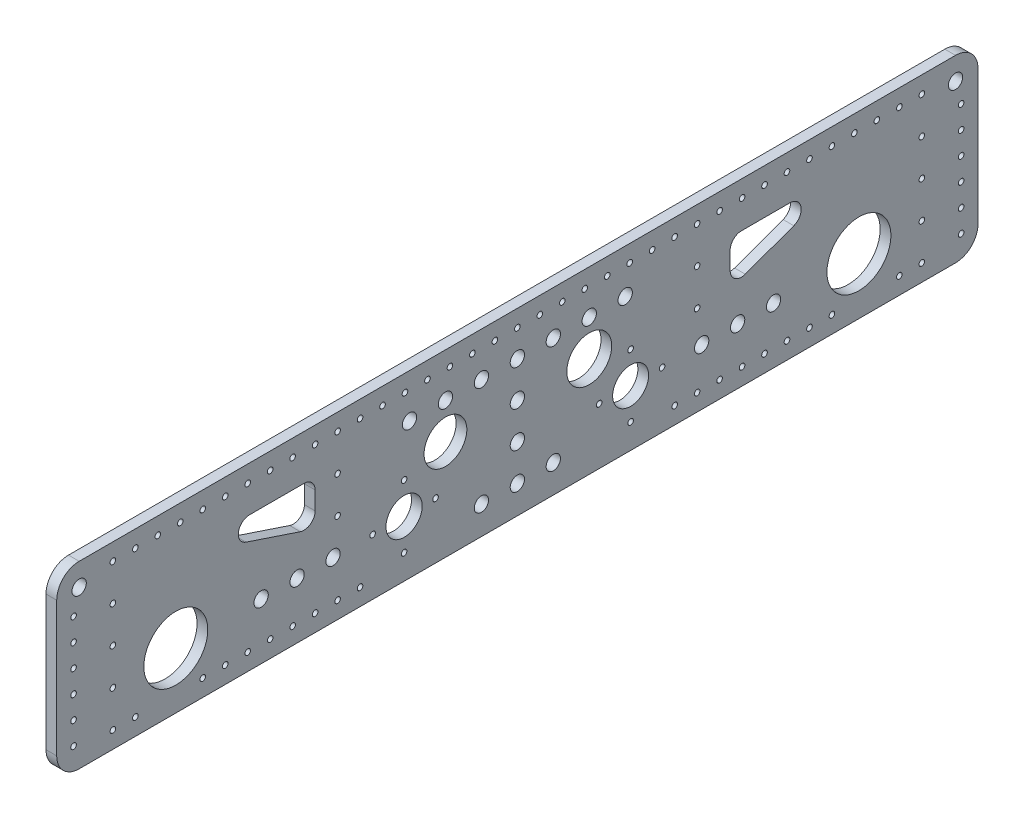
from build123d import *

# Parameters (mm, degrees)
SKETCH2_R           = 14.225
SKETCH2_R_2         = 3.18
SKETCH2_R_3         = 1.25
SKETCH2_R_4         = 8
SKETCH2_R_5         = 8.068284678
SKETCH2_R_6         = 9.513895284
SKETCH2_R_7         = 10
BOSS_EXTRUDE1_DEPTH = 4.7625


with BuildPart() as part:
    # Sketch2 → Boss-Extrude1 (new body)
    with BuildSketch(Plane(origin=(0, 0, 0), x_dir=(0, 0, -1), z_dir=(1, 0, 0))):
        with BuildLine():
            Line((-23.472321429, 28.668303571), (-23.472321429, -31.331696429))
            ThreePointArc((-23.472321429, -31.331696429), (-20.54338924, -38.40276424), (-13.472321429, -41.331696429))
            Line((-13.472321429, -41.331696429), (376.527678571, -41.331696429))
            ThreePointArc((376.527678571, -41.331696429), (383.598746383, -38.40276424), (386.527678571, -31.331696429))
            Line((386.527678571, -31.331696429), (386.527678571, 28.668303571))
            ThreePointArc((386.527678571, 28.668303571), (383.598746383, 35.739371383), (376.527678571, 38.668303571))
            Line((376.527678571, 38.668303571), (-13.472321429, 38.668303571))
            ThreePointArc((-13.472321429, 38.668303571), (-20.54338924, 35.739371383), (-23.472321429, 28.668303571))
        make_face()
        with Locations(Location((29.527678571, -16.331696429, 0), (0, 0, 180))):
            Circle(SKETCH2_R, mode=Mode.SUBTRACT)
        with Locations(Location((333.527678571, -16.331696429, 0), (0, 0, 180))):
            Circle(SKETCH2_R, mode=Mode.SUBTRACT)
        with Locations(Location((181.527678571, -28.771696429, 0), (0, 0, 180))):
            Circle(SKETCH2_R_2, mode=Mode.SUBTRACT)
        with Locations(Location((197.527678571, -28.771696429, 0), (0, 0, 180))):
            Circle(SKETCH2_R_2, mode=Mode.SUBTRACT)
        with Locations(Location((197.527678571, 19.228303571, 0), (0, 0, 180))):
            Circle(SKETCH2_R_2, mode=Mode.SUBTRACT)
        with Locations(Location((181.527678571, -12.771696429, 0), (0, 0, 180))):
            Circle(SKETCH2_R_2, mode=Mode.SUBTRACT)
        with Locations(Location((181.527678571, 3.228303571, 0), (0, 0, 180))):
            Circle(SKETCH2_R_2, mode=Mode.SUBTRACT)
        with Locations(Location((181.527678571, 19.228303571, 0), (0, 0, 180))):
            Circle(SKETCH2_R_2, mode=Mode.SUBTRACT)
        with Locations(Location((165.527678571, -28.771696429, 0), (0, 0, 180))):
            Circle(SKETCH2_R_2, mode=Mode.SUBTRACT)
        with Locations(Location((165.527678571, 19.228303571, 0), (0, 0, 180))):
            Circle(SKETCH2_R_2, mode=Mode.SUBTRACT)
        with Locations(Location((83.502678571, -16.331696429, 0), (0, 0, 180))):
            Circle(SKETCH2_R_2, mode=Mode.SUBTRACT)
        with Locations(Location((279.552678571, -16.331696429, 0), (0, 0, 180))):
            Circle(SKETCH2_R_2, mode=Mode.SUBTRACT)
        with Locations(Location((1.527678571, 31.168303571, 0), (0, 0, 180))):
            Circle(SKETCH2_R_3, mode=Mode.SUBTRACT)
        with Locations(Location((11.527678571, 31.168303571, 0), (0, 0, 180))):
            Circle(SKETCH2_R_3, mode=Mode.SUBTRACT)
        with Locations(Location((21.527678571, 31.168303571, 0), (0, 0, 180))):
            Circle(SKETCH2_R_3, mode=Mode.SUBTRACT)
        with Locations(Location((31.527678571, 31.168303571, 0), (0, 0, 180))):
            Circle(SKETCH2_R_3, mode=Mode.SUBTRACT)
        with Locations(Location((41.527678571, 31.168303571, 0), (0, 0, 180))):
            Circle(SKETCH2_R_3, mode=Mode.SUBTRACT)
        with Locations(Location((51.527678571, 31.168303571, 0), (0, 0, 180))):
            Circle(SKETCH2_R_3, mode=Mode.SUBTRACT)
        with Locations(Location((61.527678571, 31.168303571, 0), (0, 0, 180))):
            Circle(SKETCH2_R_3, mode=Mode.SUBTRACT)
        with Locations(Location((71.527678571, 31.168303571, 0), (0, 0, 180))):
            Circle(SKETCH2_R_3, mode=Mode.SUBTRACT)
        with Locations(Location((81.527678571, 31.168303571, 0), (0, 0, 180))):
            Circle(SKETCH2_R_3, mode=Mode.SUBTRACT)
        with Locations(Location((91.527678571, 31.168303571, 0), (0, 0, 180))):
            Circle(SKETCH2_R_3, mode=Mode.SUBTRACT)
        with Locations(Location((101.527678571, 31.168303571, 0), (0, 0, 180))):
            Circle(SKETCH2_R_3, mode=Mode.SUBTRACT)
        with Locations(Location((111.527678571, 31.168303571, 0), (0, 0, 180))):
            Circle(SKETCH2_R_3, mode=Mode.SUBTRACT)
        with Locations(Location((121.527678571, 31.168303571, 0), (0, 0, 180))):
            Circle(SKETCH2_R_3, mode=Mode.SUBTRACT)
        with Locations(Location((131.527678571, 31.168303571, 0), (0, 0, 180))):
            Circle(SKETCH2_R_3, mode=Mode.SUBTRACT)
        with Locations(Location((141.527678571, 31.168303571, 0), (0, 0, 180))):
            Circle(SKETCH2_R_3, mode=Mode.SUBTRACT)
        with Locations(Location((151.527678571, 31.168303571, 0), (0, 0, 180))):
            Circle(SKETCH2_R_3, mode=Mode.SUBTRACT)
        with Locations(Location((161.527678571, 31.168303571, 0), (0, 0, 180))):
            Circle(SKETCH2_R_3, mode=Mode.SUBTRACT)
        with Locations(Location((171.527678571, 31.168303571, 0), (0, 0, 180))):
            Circle(SKETCH2_R_3, mode=Mode.SUBTRACT)
        with Locations(Location((181.527678571, 31.168303571, 0), (0, 0, 180))):
            Circle(SKETCH2_R_3, mode=Mode.SUBTRACT)
        with Locations(Location((191.527678571, 31.168303571, 0), (0, 0, 180))):
            Circle(SKETCH2_R_3, mode=Mode.SUBTRACT)
        with Locations(Location((201.527678571, 31.168303571, 0), (0, 0, 180))):
            Circle(SKETCH2_R_3, mode=Mode.SUBTRACT)
        with Locations(Location((211.527678571, 31.168303571, 0), (0, 0, 180))):
            Circle(SKETCH2_R_3, mode=Mode.SUBTRACT)
        with Locations(Location((221.527678571, 31.168303571, 0), (0, 0, 180))):
            Circle(SKETCH2_R_3, mode=Mode.SUBTRACT)
        with Locations(Location((231.527678571, 31.168303571, 0), (0, 0, 180))):
            Circle(SKETCH2_R_3, mode=Mode.SUBTRACT)
        with Locations(Location((241.527678571, 31.168303571, 0), (0, 0, 180))):
            Circle(SKETCH2_R_3, mode=Mode.SUBTRACT)
        with Locations(Location((251.527678571, 31.168303571, 0), (0, 0, 180))):
            Circle(SKETCH2_R_3, mode=Mode.SUBTRACT)
        with Locations(Location((261.527678571, 31.168303571, 0), (0, 0, 180))):
            Circle(SKETCH2_R_3, mode=Mode.SUBTRACT)
        with Locations(Location((271.527678571, 31.168303571, 0), (0, 0, 180))):
            Circle(SKETCH2_R_3, mode=Mode.SUBTRACT)
        with Locations(Location((281.527678571, 31.168303571, 0), (0, 0, 180))):
            Circle(SKETCH2_R_3, mode=Mode.SUBTRACT)
        with Locations(Location((291.527678571, 31.168303571, 0), (0, 0, 180))):
            Circle(SKETCH2_R_3, mode=Mode.SUBTRACT)
        with Locations(Location((301.527678571, 31.168303571, 0), (0, 0, 180))):
            Circle(SKETCH2_R_3, mode=Mode.SUBTRACT)
        with Locations(Location((311.527678571, 31.168303571, 0), (0, 0, 180))):
            Circle(SKETCH2_R_3, mode=Mode.SUBTRACT)
        with Locations(Location((321.527678571, 31.168303571, 0), (0, 0, 180))):
            Circle(SKETCH2_R_3, mode=Mode.SUBTRACT)
        with Locations(Location((331.527678571, 31.168303571, 0), (0, 0, 180))):
            Circle(SKETCH2_R_3, mode=Mode.SUBTRACT)
        with Locations(Location((341.527678571, 31.168303571, 0), (0, 0, 180))):
            Circle(SKETCH2_R_3, mode=Mode.SUBTRACT)
        with Locations(Location((351.527678571, 31.168303571, 0), (0, 0, 180))):
            Circle(SKETCH2_R_3, mode=Mode.SUBTRACT)
        with Locations(Location((361.527678571, 31.168303571, 0), (0, 0, 180))):
            Circle(SKETCH2_R_3, mode=Mode.SUBTRACT)
        with Locations(Location((1.527678571, -33.831696429, 0), (0, 0, 180))):
            Circle(SKETCH2_R_3, mode=Mode.SUBTRACT)
        with Locations(Location((11.527678571, -33.831696429, 0), (0, 0, 180))):
            Circle(SKETCH2_R_3, mode=Mode.SUBTRACT)
        with Locations(Location((41.527678571, -33.831696429, 0), (0, 0, 180))):
            Circle(SKETCH2_R_3, mode=Mode.SUBTRACT)
        with Locations(Location((51.527678571, -33.831696429, 0), (0, 0, 180))):
            Circle(SKETCH2_R_3, mode=Mode.SUBTRACT)
        with Locations(Location((61.527678571, -33.831696429, 0), (0, 0, 180))):
            Circle(SKETCH2_R_3, mode=Mode.SUBTRACT)
        with Locations(Location((71.527678571, -33.831696429, 0), (0, 0, 180))):
            Circle(SKETCH2_R_3, mode=Mode.SUBTRACT)
        with Locations(Location((81.527678571, -33.831696429, 0), (0, 0, 180))):
            Circle(SKETCH2_R_3, mode=Mode.SUBTRACT)
        with Locations(Location((91.527678571, -33.831696429, 0), (0, 0, 180))):
            Circle(SKETCH2_R_3, mode=Mode.SUBTRACT)
        with Locations(Location((101.527678571, -33.831696429, 0), (0, 0, 180))):
            Circle(SKETCH2_R_3, mode=Mode.SUBTRACT)
        with Locations(Location((111.527678571, -33.831696429, 0), (0, 0, 180))):
            Circle(SKETCH2_R_3, mode=Mode.SUBTRACT)
        with Locations(Location((251.527678571, -33.831696429, 0), (0, 0, 180))):
            Circle(SKETCH2_R_3, mode=Mode.SUBTRACT)
        with Locations(Location((261.527678571, -33.831696429, 0), (0, 0, 180))):
            Circle(SKETCH2_R_3, mode=Mode.SUBTRACT)
        with Locations(Location((271.527678571, -33.831696429, 0), (0, 0, 180))):
            Circle(SKETCH2_R_3, mode=Mode.SUBTRACT)
        with Locations(Location((281.527678571, -33.831696429, 0), (0, 0, 180))):
            Circle(SKETCH2_R_3, mode=Mode.SUBTRACT)
        with Locations(Location((291.527678571, -33.831696429, 0), (0, 0, 180))):
            Circle(SKETCH2_R_3, mode=Mode.SUBTRACT)
        with Locations(Location((301.527678571, -33.831696429, 0), (0, 0, 180))):
            Circle(SKETCH2_R_3, mode=Mode.SUBTRACT)
        with Locations(Location((311.527678571, -33.831696429, 0), (0, 0, 180))):
            Circle(SKETCH2_R_3, mode=Mode.SUBTRACT)
        with Locations(Location((321.527678571, -33.831696429, 0), (0, 0, 180))):
            Circle(SKETCH2_R_3, mode=Mode.SUBTRACT)
        with Locations(Location((351.527678571, -33.831696429, 0), (0, 0, 180))):
            Circle(SKETCH2_R_3, mode=Mode.SUBTRACT)
        with Locations(Location((361.527678571, -33.831696429, 0), (0, 0, 180))):
            Circle(SKETCH2_R_3, mode=Mode.SUBTRACT)
        with Locations(Location((-13.472321429, 28.668303571, 0), (0, 0, 180))):
            Circle(SKETCH2_R_2, mode=Mode.SUBTRACT)
        with Locations(Location((376.527678571, 28.668303571, 0), (0, 0, 180))):
            Circle(SKETCH2_R_2, mode=Mode.SUBTRACT)
        with Locations(Location((295.552678571, -16.331696429, 0), (0, 0, 180))):
            Circle(SKETCH2_R_2, mode=Mode.SUBTRACT)
        with Locations(Location((67.502678571, -16.331696429, 0), (0, 0, 180))):
            Circle(SKETCH2_R_2, mode=Mode.SUBTRACT)
        with Locations(Location((263.552678571, -16.331696429, 0), (0, 0, 180))):
            Circle(SKETCH2_R_2, mode=Mode.SUBTRACT)
        with Locations(Location((131.127678571, -30.331696429, 0), (0, 0, 180))):
            Circle(SKETCH2_R_3, mode=Mode.SUBTRACT)
        with Locations(Location((145.127678571, -16.331696429, 0), (0, 0, 180))):
            Circle(SKETCH2_R_3, mode=Mode.SUBTRACT)
        with Locations(Location((131.127678571, -2.331696429, 0), (0, 0, 180))):
            Circle(SKETCH2_R_3, mode=Mode.SUBTRACT)
        with Locations(Location((117.127678571, -16.331696429, 0), (0, 0, 180))):
            Circle(SKETCH2_R_3, mode=Mode.SUBTRACT)
        with Locations(Location((231.927678571, -30.331696429, 0), (0, 0, 180))):
            Circle(SKETCH2_R_3, mode=Mode.SUBTRACT)
        with Locations(Location((217.927678571, -16.331696429, 0), (0, 0, 180))):
            Circle(SKETCH2_R_3, mode=Mode.SUBTRACT)
        with Locations(Location((231.927678571, -2.331696429, 0), (0, 0, 180))):
            Circle(SKETCH2_R_3, mode=Mode.SUBTRACT)
        with Locations(Location((245.927678571, -16.331696429, 0), (0, 0, 180))):
            Circle(SKETCH2_R_3, mode=Mode.SUBTRACT)
        with Locations(Location((231.927678571, -16.331696429, 0), (0, 0, 180))):
            Circle(SKETCH2_R_4, mode=Mode.SUBTRACT)
        with Locations(Location((131.127678571, -16.331696429, 0), (0, 0, 180))):
            Circle(SKETCH2_R_5, mode=Mode.SUBTRACT)
        with Locations(Location((-15.972321429, 18.668303571, 0), (0, 0, 180))):
            Circle(SKETCH2_R_3, mode=Mode.SUBTRACT)
        with Locations(Location((379.027678571, 18.668303571, 0), (0, 0, 180))):
            Circle(SKETCH2_R_3, mode=Mode.SUBTRACT)
        with Locations(Location((379.027678571, 8.668303571, 0), (0, 0, 180))):
            Circle(SKETCH2_R_3, mode=Mode.SUBTRACT)
        with Locations(Location((379.027678571, -1.331696429, 0), (0, 0, 180))):
            Circle(SKETCH2_R_3, mode=Mode.SUBTRACT)
        with Locations(Location((379.027678571, -11.331696429, 0), (0, 0, 180))):
            Circle(SKETCH2_R_3, mode=Mode.SUBTRACT)
        with Locations(Location((379.027678571, -21.331696429, 0), (0, 0, 180))):
            Circle(SKETCH2_R_3, mode=Mode.SUBTRACT)
        with Locations(Location((379.027678571, -31.331696429, 0), (0, 0, 180))):
            Circle(SKETCH2_R_3, mode=Mode.SUBTRACT)
        with Locations(Location((-15.972321429, 8.668303571, 0), (0, 0, 180))):
            Circle(SKETCH2_R_3, mode=Mode.SUBTRACT)
        with Locations(Location((-15.972321429, -1.331696429, 0), (0, 0, 180))):
            Circle(SKETCH2_R_3, mode=Mode.SUBTRACT)
        with Locations(Location((-15.972321429, -11.331696429, 0), (0, 0, 180))):
            Circle(SKETCH2_R_3, mode=Mode.SUBTRACT)
        with Locations(Location((-15.972321429, -21.331696429, 0), (0, 0, 180))):
            Circle(SKETCH2_R_3, mode=Mode.SUBTRACT)
        with Locations(Location((-15.972321429, -31.331696429, 0), (0, 0, 180))):
            Circle(SKETCH2_R_3, mode=Mode.SUBTRACT)
        with Locations(Location((101.527678571, -1.331696429, 0), (0, 0, 180))):
            Circle(SKETCH2_R_3, mode=Mode.SUBTRACT)
        with Locations(Location((101.527678571, 14.918303571, 0), (0, 0, 180))):
            Circle(SKETCH2_R_3, mode=Mode.SUBTRACT)
        with Locations(Location((361.527678571, -17.581696429, 0), (0, 0, 180))):
            Circle(SKETCH2_R_3, mode=Mode.SUBTRACT)
        with Locations(Location((361.527678571, -1.331696429, 0), (0, 0, 180))):
            Circle(SKETCH2_R_3, mode=Mode.SUBTRACT)
        with Locations(Location((361.527678571, 14.918303571, 0), (0, 0, 180))):
            Circle(SKETCH2_R_3, mode=Mode.SUBTRACT)
        with Locations(Location((1.527678571, -17.581696429, 0), (0, 0, 180))):
            Circle(SKETCH2_R_3, mode=Mode.SUBTRACT)
        with Locations(Location((1.527678571, -1.331696429, 0), (0, 0, 180))):
            Circle(SKETCH2_R_3, mode=Mode.SUBTRACT)
        with Locations(Location((1.527678571, 14.918303571, 0), (0, 0, 180))):
            Circle(SKETCH2_R_3, mode=Mode.SUBTRACT)
        with Locations(Location((99.502678571, -16.331696429, 0), (0, 0, 180))):
            Circle(SKETCH2_R_2, mode=Mode.SUBTRACT)
        with Locations(Location((261.527678571, -1.331696429, 0), (0, 0, 180))):
            Circle(SKETCH2_R_3, mode=Mode.SUBTRACT)
        with Locations(Location((261.527678571, 14.918303571, 0), (0, 0, 180))):
            Circle(SKETCH2_R_3, mode=Mode.SUBTRACT)
        with Locations(Location((149.527678571, 19.228303571, 0), (0, 0, 180))):
            Circle(SKETCH2_R_2, mode=Mode.SUBTRACT)
        with Locations(Location((133.527678571, 19.228303571, 0), (0, 0, 180))):
            Circle(SKETCH2_R_2, mode=Mode.SUBTRACT)
        with Locations(Location((213.527678571, 19.228303571, 0), (0, 0, 180))):
            Circle(SKETCH2_R_2, mode=Mode.SUBTRACT)
        with Locations(Location((229.527678571, 19.228303571, 0), (0, 0, 180))):
            Circle(SKETCH2_R_2, mode=Mode.SUBTRACT)
        with Locations(Location((149.527678571, 3.228303571, 0), (0, 0, 180))):
            Circle(SKETCH2_R_6, mode=Mode.SUBTRACT)
        with Locations(Location((213.527678571, 3.228303571, 0), (0, 0, 180))):
            Circle(SKETCH2_R_7, mode=Mode.SUBTRACT)
        with BuildLine():
            Line((91.527678571, 13.668303571), (91.527678571, 5.605433005))
            ThreePointArc((91.527678571, 5.605433005), (89.451229995, 1.549222079), (84.946539741, 0.862016515))
            Line((84.946539741, 0.862016515), (60.757928042, 8.924887081))
            ThreePointArc((60.757928042, 8.924887081), (57.403629584, 14.469214786), (62.339066872, 18.668303571))
            Line((62.339066872, 18.668303571), (86.527678571, 18.668303571))
            ThreePointArc((86.527678571, 18.668303571), (90.063212477, 17.203837477), (91.527678571, 13.668303571))
        make_face(mode=Mode.SUBTRACT)
        with BuildLine():
            Line((276.235165394, 13.668303571), (276.235165394, 5.806803531))
            ThreePointArc((276.235165394, 5.806803531), (278.366679433, 1.711466147), (282.94388071, 1.107836413))
            Line((282.94388071, 1.107836413), (304.563005821, 8.969336454))
            ThreePointArc((304.563005821, 8.969336454), (307.778457216, 14.535818532), (302.854290506, 18.668303571))
            Line((302.854290506, 18.668303571), (281.235165394, 18.668303571))
            ThreePointArc((281.235165394, 18.668303571), (277.699631488, 17.203837477), (276.235165394, 13.668303571))
        make_face(mode=Mode.SUBTRACT)
    extrude(amount=BOSS_EXTRUDE1_DEPTH)


solid = part.part
